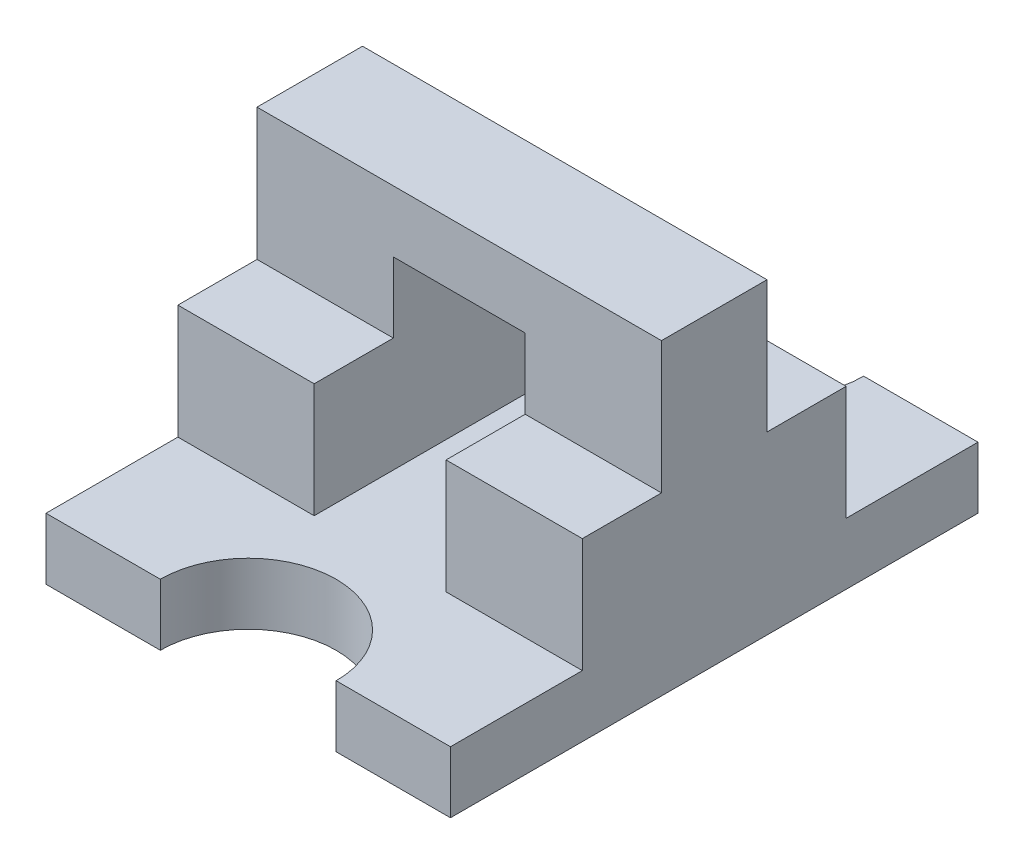
from build123d import *

# Parameters (mm, degrees)
SKETCH1_W               = 12
SKETCH1_H               = 7
BOSS_EXTRUDE1_DEPTH     = 46
CUT_EXTRUDE2_DEPTH      = 46
CUT_EXTRUDE2_DEPTH_BACK = 46
SKETCH6_W               = 15
SKETCH6_H               = 21
CUT_EXTRUDE3_DEPTH      = 60


with BuildPart() as part:
    # Sketch1 → Boss-Extrude1 (new body)
    with BuildSketch(Plane(origin=(0, 0, 0), x_dir=(0, 0, -1), z_dir=(1, 0, 0))):
        with Locations((30, 31.5)):
            Rectangle(SKETCH1_W, SKETCH1_H)
        Polygon((0, 7), (0, 0), (60, 0), (60, 7), (45, 7), (45, 20), (36, 20), (36, 28), (24, 28), (24, 20), (15, 20), (15, 7), align=None)
    extrude(amount=BOSS_EXTRUDE1_DEPTH)

    # Sketch2 → Cut-Extrude2 (cut, two sides: drawn at the far end of the back side and taken through both)
    with BuildSketch(Plane(origin=(0, 0, 0), x_dir=(1, 0, 0), z_dir=(0, 1, 0)).offset(-CUT_EXTRUDE2_DEPTH_BACK)):
        with BuildLine():
            ThreePointArc((33, 0), (23, 10), (13, 0))
            Line((13, 0), (33, 0))
        make_face()
        with BuildLine():
            Line((33, 0), (13, 0))
            ThreePointArc((13, 0), (23, -10), (33, 0))
        make_face()
        with BuildLine():
            ThreePointArc((33, 60), (23, 70), (13, 60))
            Line((13, 60), (33, 60))
        make_face()
        with BuildLine():
            Line((33, 60), (13, 60))
            ThreePointArc((13, 60), (23, 50), (33, 60))
        make_face()
    extrude(amount=CUT_EXTRUDE2_DEPTH + CUT_EXTRUDE2_DEPTH_BACK, mode=Mode.SUBTRACT)

    # Sketch6 → Cut-Extrude3 (cut)
    with BuildSketch(Plane.XY):
        with Locations((23, 17.5)):
            Rectangle(SKETCH6_W, SKETCH6_H)
    extrude(amount=-CUT_EXTRUDE3_DEPTH, mode=Mode.SUBTRACT)


solid = part.part
